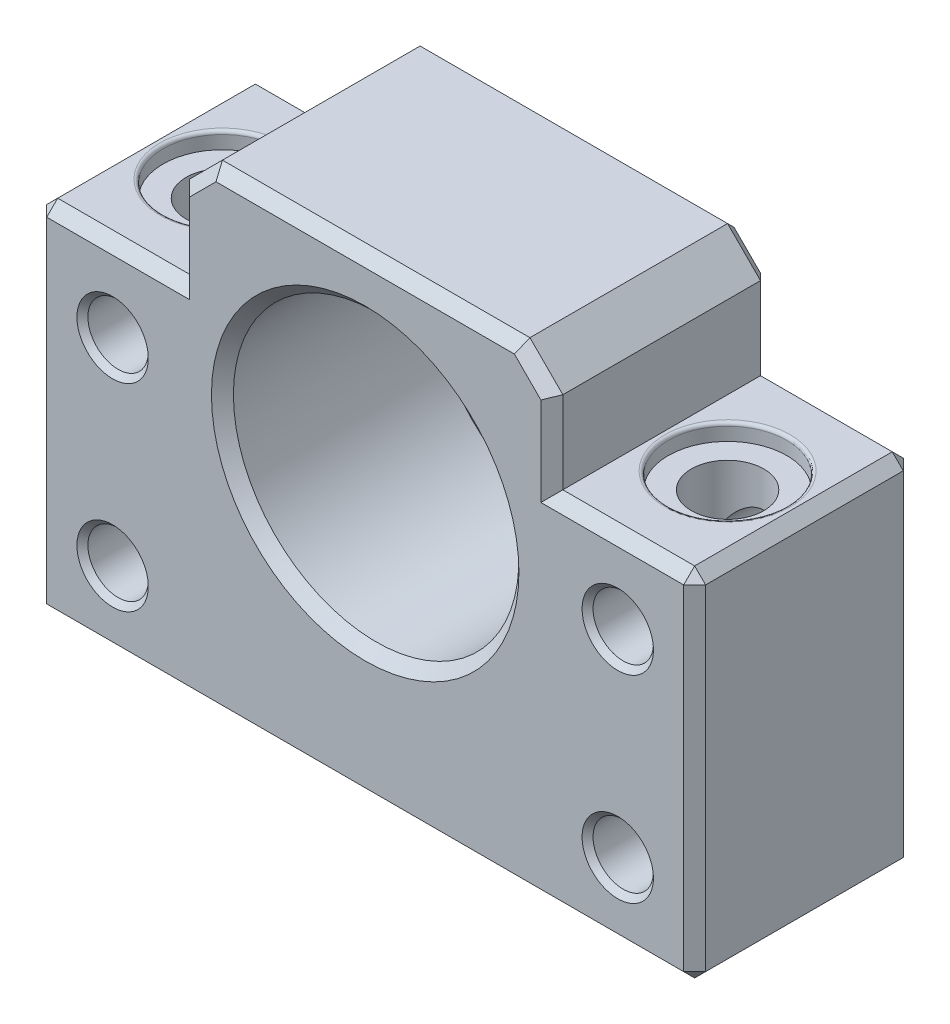
from build123d import *

# Parameters (mm, degrees)
SKETCH1_R           = 13
BOSS_EXTRUDE1_DEPTH = 20
CHAMFER1_SIZE       = 3
CHAMFER2_SIZE       = 1
SKETCH2_R           = 2.75
CUT_EXTRUDE1_DEPTH  = 57.115951386
CUT_EXTRUDE2_REACH  = 58.116
SKETCH3_R           = 3.3
SKETCH4_R           = 5.4
CUT_EXTRUDE3_DEPTH  = 1.5
CHAMFER3_SIZE       = 0.5
FILLET1_R           = 0.3


with BuildPart() as part:
    # Sketch1 → Boss-Extrude1 (new body)
    with BuildSketch(Plane.XY):
        Polygon((17, 0), (-17, 0), (-17, -10.5), (-30, -10.5), (-30, -43), (30, -43), (30, -10.5), (17, -10.5), align=None)
        with Locations((0, -18)):
            Circle(SKETCH1_R, mode=Mode.SUBTRACT)
    extrude(amount=BOSS_EXTRUDE1_DEPTH)

    # Chamfer1
    chamfer1_edges = [part.edges().sort_by_distance(p)[0] for p in [
        (-17, 0, 10),
        (17, 0, 10),
    ]]
    chamfer(chamfer1_edges, length=CHAMFER1_SIZE)

    # Chamfer2
    chamfer2_edges = [part.edges().sort_by_distance(p)[0] for p in [
        (23.5, -10.5, 20),
        (30, -26.75, 0),
        (0, -43, 0),
        (17, -6.75, 20),
        (-30, -43, 10),
        (-30, -10.5, 10),
        (30, -10.5, 10),
        (30, -43, 10),
        (-13, -18, 0),
        (-13, -18, 20),
        (-23.5, -10.5, 20),
        (-30, -26.75, 20),
        (0, 0, 0),
        (0, 0, 20),
        (-17, -6.75, 0),
        (-15.5, -1.5, 0),
        (15.5, -1.5, 0),
        (-17, -6.75, 20),
        (-15.5, -1.5, 20),
        (15.5, -1.5, 20),
        (0, -43, 20),
        (30, -26.75, 20),
        (-30, -26.75, 0),
        (-23.5, -10.5, 0),
        (17, -6.75, 0),
        (23.5, -10.5, 0),
    ]]
    chamfer(chamfer2_edges, length=CHAMFER2_SIZE)

    # Sketch2 → Cut-Extrude1 (cut, through all)
    with BuildSketch(Plane(origin=(0, 0, 0), x_dir=(-1, 0, 0), z_dir=(0, 0, -1))):
        with Locations((-23, -18)):
            Circle(SKETCH2_R)
        with Locations(Location((23, -18, 0), (0, 0, 180))):
            Circle(SKETCH2_R)
        with Locations((23, -36)):
            Circle(SKETCH2_R)
        with Locations(Location((-23, -36, 0), (0, 0, 180))):
            Circle(SKETCH2_R)
    extrude(amount=-CUT_EXTRUDE1_DEPTH, mode=Mode.SUBTRACT)

    # Sketch3 → Cut-Extrude2 (cut, up to next)
    with BuildSketch(Plane.XZ.offset(43), mode=Mode.PRIVATE) as cut_extrude2_sk1:
        with Locations((23, 10)):
            Circle(SKETCH3_R)
    cut_extrude2_tool1 = extrude(cut_extrude2_sk1.sketch, amount=-CUT_EXTRUDE2_REACH, mode=Mode.PRIVATE) & part.part
    # Sketch3 → Cut-Extrude2 (cut, up to next)
    with BuildSketch(Plane.XZ.offset(43), mode=Mode.PRIVATE) as cut_extrude2_sk2:
        with Locations(Location((-23, 10, 0), (0, 0, 270))):
            Circle(SKETCH3_R)
    cut_extrude2_tool2 = extrude(cut_extrude2_sk2.sketch, amount=-CUT_EXTRUDE2_REACH, mode=Mode.PRIVATE) & part.part
    add(cut_extrude2_tool1.solids().sort_by_distance((23, -43, 10))[0], mode=Mode.SUBTRACT)
    add(cut_extrude2_tool2.solids().sort_by_distance((-23, -43, 10))[0], mode=Mode.SUBTRACT)

    # Sketch4 → Cut-Extrude3 (cut)
    with BuildSketch(Plane(origin=(0, -10.5, 0), x_dir=(1, 0, 0), z_dir=(0, 1, 0))):
        with Locations(Location((23, -10, 0), (0, 0, 180))):
            Circle(SKETCH4_R)
        with Locations((-23, -10)):
            Circle(SKETCH4_R)
    extrude(amount=-CUT_EXTRUDE3_DEPTH, mode=Mode.SUBTRACT)

    # Chamfer3
    chamfer3_edges = [part.edges().sort_by_distance(p)[0] for p in [
        (25.75, -18, 20),
        (25.75, -18, 0),
        (-25.75, -18, 20),
        (-25.75, -18, 0),
        (-20.25, -36, 20),
        (-20.25, -36, 0),
        (20.25, -36, 20),
        (20.25, -36, 0),
        (19.7, -43, 10),
        (-23, -43, 13.3),
    ]]
    chamfer(chamfer3_edges, length=CHAMFER3_SIZE)

    # Fillet1
    fillet1_edges = [part.edges().sort_by_distance(p)[0] for p in [
        (28.4, -10.5, 10),
        (-28.4, -10.5, 10),
    ]]
    fillet(fillet1_edges, radius=FILLET1_R)


solid = part.part
